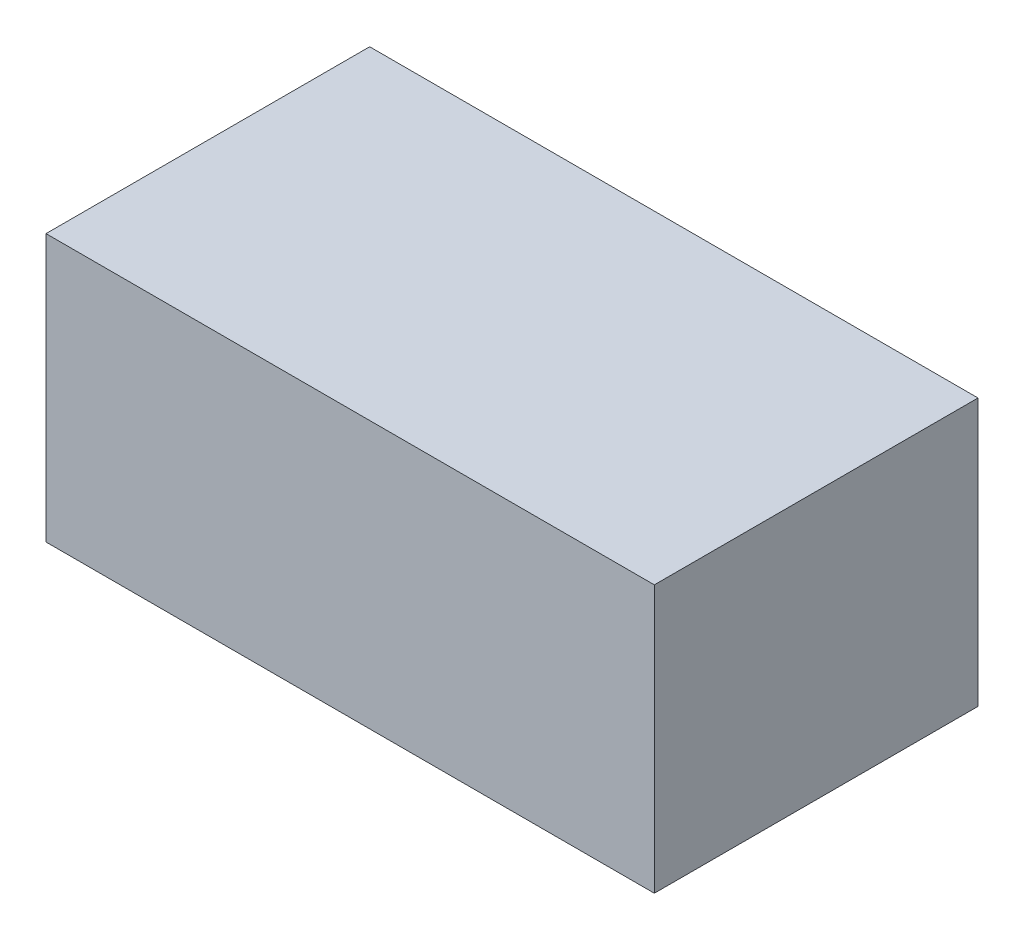
from build123d import *

# Parameters (mm, degrees)
SKETCH1_W           = 56.938967001
SKETCH1_H           = 30.293318486
BOSS_EXTRUDE1_DEPTH = 25
SCALE1_SCALE        = 0.5


with BuildPart() as part:
    # Sketch1 → Boss-Extrude1 (new body)
    with BuildSketch(Plane(origin=(0, 0, 0), x_dir=(1, 0, 0), z_dir=(0, 1, 0))):
        with Locations((28.469483501, 15.146659243)):
            Rectangle(SKETCH1_W, SKETCH1_H)
    extrude(amount=BOSS_EXTRUDE1_DEPTH)


with BuildPart() as part_1:
    # Scale1: scaled about (28.4694835, 12.5, -15.146659243)
    add(part.part.scale(SCALE1_SCALE).moved(Location((14.23474175, 6.25, -7.573329622))))


solid = part_1.part
